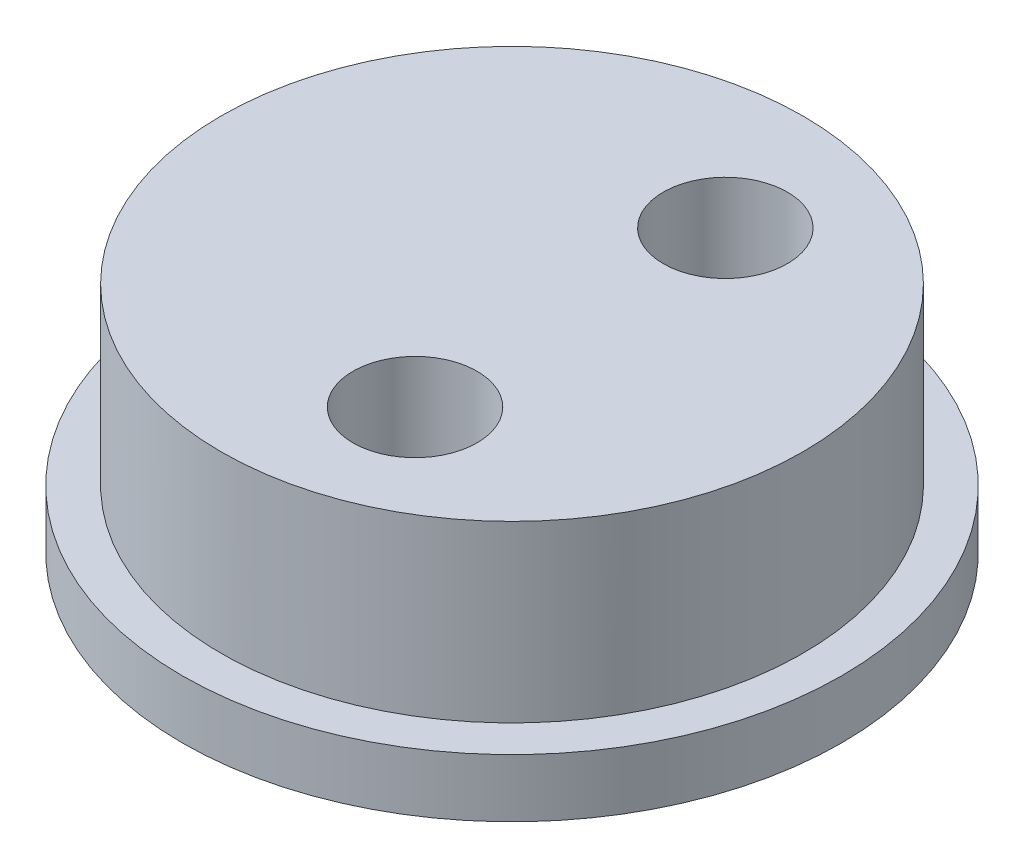
from build123d import *

# Parameters (mm, degrees)
SKETCH1_R           = 7.5
BOSS_EXTRUDE1_DEPTH = 6
SKETCH2_R           = 8.5
BOSS_EXTRUDE2_DEPTH = 1.5
SKETCH4_R           = 1.6
CUT_EXTRUDE1_DEPTH  = 15.43086969


with BuildPart() as part:
    # Sketch1 → Boss-Extrude1 (new body)
    with BuildSketch(Plane(origin=(0, 0, 0), x_dir=(1, 0, 0), z_dir=(0, 1, 0))):
        with Locations(Location((-1.5, 0, 0), (0, 0, 270))):
            Circle(SKETCH1_R)
    extrude(amount=BOSS_EXTRUDE1_DEPTH)

    # Sketch2 → Boss-Extrude2 (add)
    with BuildSketch(Plane.XZ):
        with Locations(Location((-1.5, 0, 0), (0, 0, 270))):
            Circle(SKETCH2_R)
    extrude(amount=-BOSS_EXTRUDE2_DEPTH)

    # Sketch4 → Cut-Extrude1 (cut, through all)
    with BuildSketch(Plane(origin=(0, 6, 0), x_dir=(1, 0, 0), z_dir=(0, 1, 0))):
        with Locations(Location((0, 4, 0), (0, 0, 270))):
            Circle(SKETCH4_R)
        with Locations(Location((0, -4, 0), (0, 0, 270))):
            Circle(SKETCH4_R)
    extrude(amount=-CUT_EXTRUDE1_DEPTH, mode=Mode.SUBTRACT)


solid = part.part
